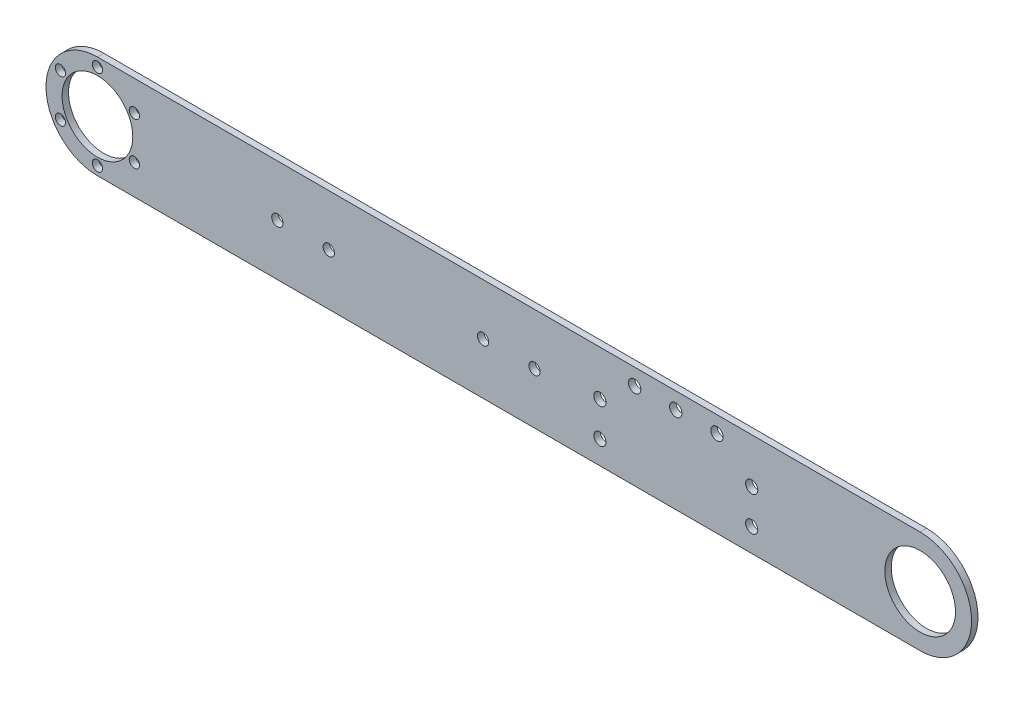
from build123d import *

# Parameters (mm, degrees)
BOSS_EXTRUDE1_DEPTH    = 3.175
SKETCH2_R              = 17.4625
CUT_EXTRUDE1_DEPTH     = 435.789559011
F_10_CLEARANCE_HOLE1_D = 5.1054
SKETCH4_R              = 2.794
CUT_EXTRUDE2_DEPTH     = 435.789559011
SKETCH7_R              = 3.048
CUT_EXTRUDE3_DEPTH     = 435.789559011
SKETCH8_R              = 3
CUT_EXTRUDE4_DEPTH     = 435.789559011


with BuildPart() as part:
    # Sketch1 → Boss-Extrude1 (new body)
    with BuildSketch(Plane.XY):
        with BuildLine():
            Line((0, 0), (406.4, 0))
            ThreePointArc((406.4, 0), (431.8, 25.4), (406.4, 50.8))
            Line((406.4, 50.8), (0, 50.8))
            ThreePointArc((0, 50.8), (-25.4, 25.4), (0, 0))
        make_face()
    extrude(amount=BOSS_EXTRUDE1_DEPTH)

    # Sketch2 → Cut-Extrude1 (cut, through all)
    with BuildSketch(Plane.XY.offset(3.175)):
        with Locations((0, 25.4)):
            Circle(SKETCH2_R)
        with Locations((406.4, 25.4)):
            Circle(SKETCH2_R)
    extrude(amount=-CUT_EXTRUDE1_DEPTH, mode=Mode.SUBTRACT)

    # #10 Clearance Hole1 (through all)
    with Locations(Plane(origin=(18.257547563, 35.941, 3.175), x_dir=(1, 0, 0), z_dir=(0, 0, 1))):
        with Locations((0, 0), (0, -21.082), (-18.257547563, -31.623), (-36.515095126, -21.082), (-36.515095126, 0), (-18.257547563, 10.541)):
            Hole(F_10_CLEARANCE_HOLE1_D / 2)

    # Sketch4 → Cut-Extrude2 (cut, through all)
    with BuildSketch(Plane.XY.offset(3.175)):
        with Locations((88.9, 25.4)):
            Circle(SKETCH4_R)
        with Locations((114.3, 25.4)):
            Circle(SKETCH4_R)
        with Locations((190.5, 25.4)):
            Circle(SKETCH4_R)
        with Locations((215.9, 25.4)):
            Circle(SKETCH4_R)
    extrude(amount=-CUT_EXTRUDE2_DEPTH, mode=Mode.SUBTRACT)

    # Sketch7 → Cut-Extrude3 (cut, through all)
    with BuildSketch(Plane.XY.offset(3.175)):
        with Locations((306.015176825, 42.672)):
            Circle(SKETCH7_R)
        with Locations((285.695176825, 42.672)):
            Circle(SKETCH7_R)
        with Locations((265.375176825, 42.672)):
            Circle(SKETCH7_R)
    extrude(amount=-CUT_EXTRUDE3_DEPTH, mode=Mode.SUBTRACT)

    # Sketch8 → Cut-Extrude4 (cut, through all)
    with BuildSketch(Plane.XY.offset(3.175)):
        with Locations((323.195176825, 11.543289628)):
            Circle(SKETCH8_R)
        with Locations((323.195176825, 28.543289628)):
            Circle(SKETCH8_R)
        with Locations((248.195176825, 11.543289628)):
            Circle(SKETCH8_R)
        with Locations((248.195176825, 28.543289628)):
            Circle(SKETCH8_R)
    extrude(amount=-CUT_EXTRUDE4_DEPTH, mode=Mode.SUBTRACT)


solid = part.part
